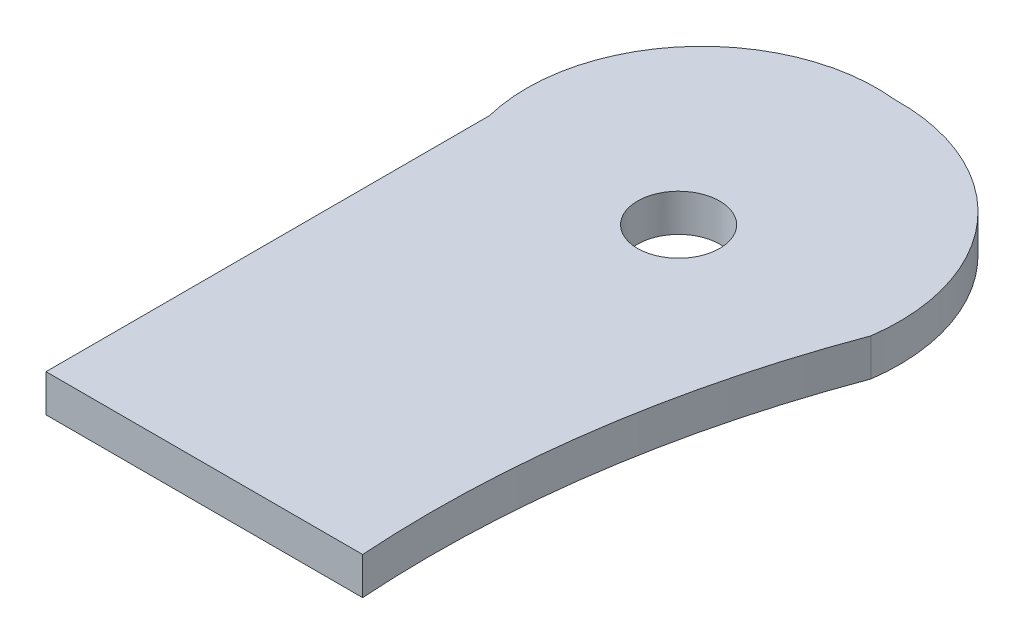
from build123d import *

# Parameters (mm, degrees)
SKETCH1_R           = 7.9375
BOSS_EXTRUDE1_DEPTH = 11.1125
SKETCH2_R           = 12.20390625
CUT_EXTRUDE1_DEPTH  = 11.1125


with BuildPart() as part:
    # Sketch1 → Boss-Extrude1 (new body)
    with BuildSketch(Plane(origin=(0, 0, 0), x_dir=(1, 0, 0), z_dir=(0, 1, 0))):
        with BuildLine():
            Line((-56.1578125, 0), (-56.1578125, -131.7625))
            Line((-56.1578125, -131.7625), (37.9015625, -131.7625))
            ThreePointArc((37.9015625, -131.7625), (40.48606485, -64.852857695), (57.15, 0))
            ThreePointArc((57.15, 0), (43.44844613, 45.367716005), (0, 64.29375))
            ThreePointArc((0, 64.29375), (-44.848953518, 46.794786657), (-56.1578125, 0))
        make_face()
        with Locations(Location((0, 0, 0), (0, 0, 270))):
            Circle(SKETCH1_R, mode=Mode.SUBTRACT)
    extrude(amount=BOSS_EXTRUDE1_DEPTH)

    # Sketch2 → Cut-Extrude1 (cut)
    with BuildSketch(Plane(origin=(0, 11.1125, 0), x_dir=(1, 0, 0), z_dir=(0, 1, 0))):
        with Locations(Location((0, 0, 0), (0, 0, 270))):
            Circle(SKETCH2_R)
    extrude(amount=-CUT_EXTRUDE1_DEPTH, mode=Mode.SUBTRACT)


solid = part.part
